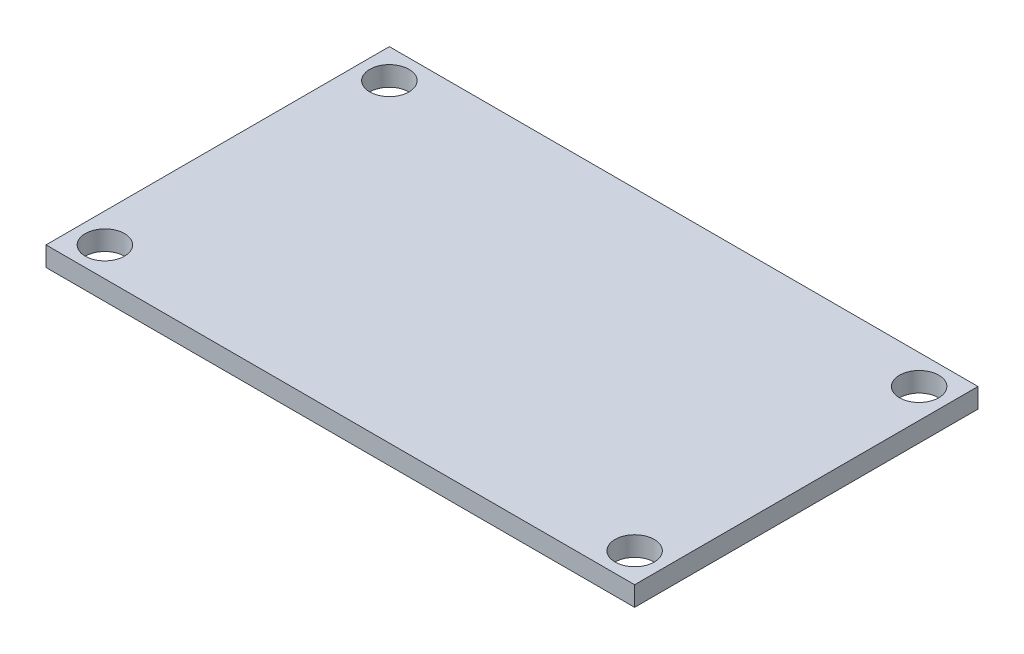
from build123d import *

# Parameters (mm, degrees)
SKETCH1_W           = 60
SKETCH1_H           = 35
SKETCH1_R           = 2
BOSS_EXTRUDE1_DEPTH = 2


with BuildPart() as part:
    # Sketch1 → Boss-Extrude1 (new body)
    with BuildSketch(Plane(origin=(0, 1.6, 0), x_dir=(1, 0, 0), z_dir=(0, 1, 0))):
        with Locations((-70.617927732, 47.080809747)):
            Rectangle(SKETCH1_W, SKETCH1_H)
        with Locations(Location((-43.617927732, 61.580809747, 0), (0, 0, 270))):
            Circle(SKETCH1_R, mode=Mode.SUBTRACT)
        with Locations(Location((-43.617927732, 32.580809747, 0), (0, 0, 270))):
            Circle(SKETCH1_R, mode=Mode.SUBTRACT)
        with Locations(Location((-97.617927732, 32.580809747, 0), (0, 0, 270))):
            Circle(SKETCH1_R, mode=Mode.SUBTRACT)
        with Locations(Location((-97.617927732, 61.580809747, 0), (0, 0, 270))):
            Circle(SKETCH1_R, mode=Mode.SUBTRACT)
    extrude(amount=-BOSS_EXTRUDE1_DEPTH)


solid = part.part
